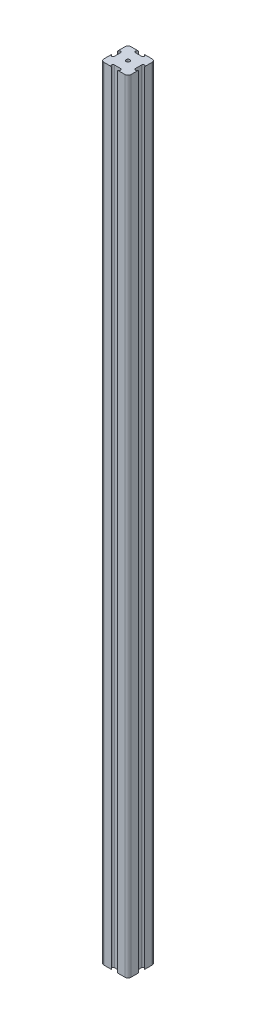
from build123d import *

# Parameters (mm, degrees)
BOSS_EXTRU_2_DEPTH      = 1300
ESQUISSE5_R             = 3
ENL_V_MAT_EXTRU_1_DEPTH = 1301.389364767


with BuildPart() as part:
    # Esquisse4 → Boss.-Extru.2 (new body)
    with BuildSketch(Plane(origin=(0, 0, 0), x_dir=(1, 0, 0), z_dir=(0, 1, 0))):
        with BuildLine():
            Line((-17.5, 22.5), (-5, 22.5))
            ThreePointArc((-5, 22.5), (-7.5, 20), (-5, 17.5))
            Line((-5, 17.5), (5, 17.5))
            ThreePointArc((5, 17.5), (7.5, 20), (5, 22.5))
            Line((5, 22.5), (17.5, 22.5))
            ThreePointArc((17.5, 22.5), (21.035534799, 21.035533013), (22.5, 17.499997475))
            Line((22.5, 17.499997475), (22.5, 4.999997475))
            ThreePointArc((22.5, 4.999997475), (20, 7.499997475), (17.5, 4.999997475))
            Line((17.5, 4.999997475), (17.5, -5.000002525))
            ThreePointArc((17.5, -5.000002525), (20, -7.500002525), (22.5, -5.000002525))
            Line((22.5, -5.000002525), (22.5, -17.500002525))
            ThreePointArc((22.5, -17.500002525), (21.035533013, -21.035534799), (17.5, -22.5))
            Line((17.5, -22.5), (5, -22.5))
            ThreePointArc((5, -22.5), (7.5, -20), (5, -17.5))
            Line((5, -17.5), (-5, -17.5))
            ThreePointArc((-5, -17.5), (-7.5, -20), (-5, -22.5))
            Line((-5, -22.5), (-17.5, -22.5))
            ThreePointArc((-17.5, -22.5), (-21.035533906, -21.035533906), (-22.5, -17.5))
            Line((-22.5, -17.5), (-22.5, -5))
            ThreePointArc((-22.5, -5), (-20, -7.5), (-17.5, -5))
            Line((-17.5, -5), (-17.5, 5))
            ThreePointArc((-17.5, 5), (-20, 7.5), (-22.5, 5))
            Line((-22.5, 5), (-22.5, 17.5))
            ThreePointArc((-22.5, 17.5), (-21.035533906, 21.035533906), (-17.5, 22.5))
        make_face()
    extrude(amount=BOSS_EXTRU_2_DEPTH)

    # Esquisse5 → Enlèv. mat.-Extru.1 (cut, through all)
    with BuildSketch(Plane.XZ):
        with Locations(Location((0, 0, 0), (0, 0, 270))):
            Circle(ESQUISSE5_R)
    extrude(amount=-ENL_V_MAT_EXTRU_1_DEPTH, mode=Mode.SUBTRACT)


solid = part.part
